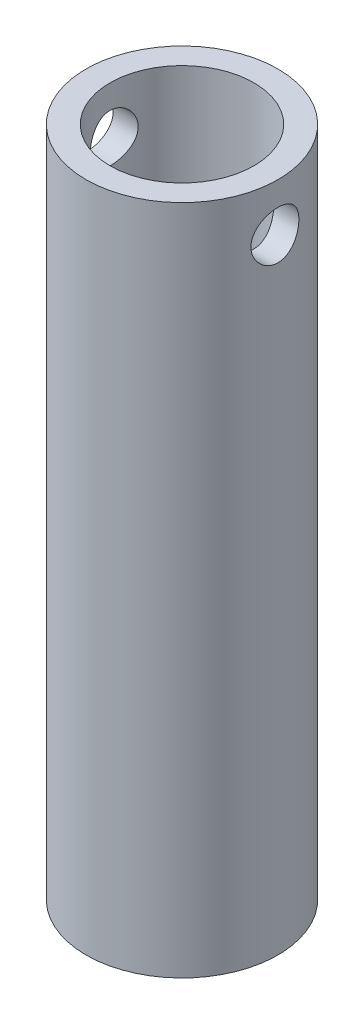
from build123d import *

# Parameters (mm, degrees)
SKETCH1_R               = 12.7
SKETCH1_R_2             = 9.525
BOSS_EXTRUDE1_DEPTH     = 88.9
CUT_EXTRUDE1_DEPTH      = 91.696141042
CUT_EXTRUDE1_DEPTH_BACK = 91.696141042
SKETCH2_R               = 3.175


with BuildPart() as part:
    # Sketch1 → Boss-Extrude1 (new body)
    with BuildSketch(Plane(origin=(0, 0, 0), x_dir=(1, 0, 0), z_dir=(0, 1, 0))):
        with Locations(Location((0, 0, 0), (0, 0, 270))):
            Circle(SKETCH1_R)
        with Locations(Location((0, 0, 0), (0, 0, 270))):
            Circle(SKETCH1_R_2, mode=Mode.SUBTRACT)
    extrude(amount=BOSS_EXTRUDE1_DEPTH)

    # Sketch2 → Cut-Extrude1 (cut, two sides: drawn at the far end of the back side and taken through both)
    with BuildSketch(Plane(origin=(0, 0, 0), x_dir=(0, 0, -1), z_dir=(1, 0, 0)).offset(-CUT_EXTRUDE1_DEPTH_BACK)):
        with Locations((0, 82.55)):
            Circle(SKETCH2_R)
    extrude(amount=CUT_EXTRUDE1_DEPTH + CUT_EXTRUDE1_DEPTH_BACK, mode=Mode.SUBTRACT)


solid = part.part
